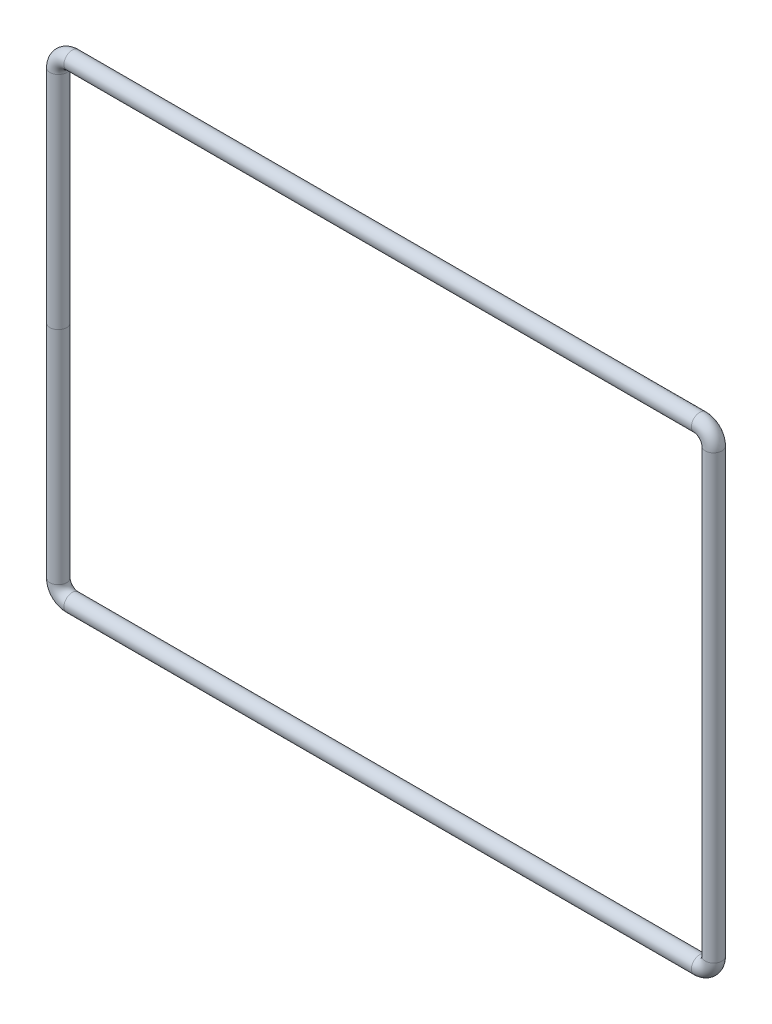
from build123d import *

# Parameters (mm, degrees)
SKETCH_2_R = 0.9


with BuildPart() as part:
    # По траектории1: sweep along a path in Эскиз1
    with BuildLine(Plane.XY) as sweep_1_path:
        Line((-33.8, 25.3), (33.8, 25.3))
        ThreePointArc((33.8, 25.3), (34.860660172, 24.860660172), (35.3, 23.8))
        Line((35.3, 23.8), (35.3, -23.8))
        ThreePointArc((35.3, -23.8), (34.860660172, -24.860660172), (33.8, -25.3))
        Line((33.8, -25.3), (-33.8, -25.3))
        ThreePointArc((-33.8, -25.3), (-34.860660172, -24.860660172), (-35.3, -23.8))
        Line((-35.3, -23.8), (-35.3, 23.8))
        ThreePointArc((-35.3, 23.8), (-34.860660172, 24.860660172), (-33.8, 25.3))
    # Эскиз2 → По траектории1 (sweep)
    with BuildSketch(Plane(origin=(0, 0, 0), x_dir=(-1, 0, 0), z_dir=(0, -1, 0))):
        with Locations((35.3, 0)):
            Circle(SKETCH_2_R)
    sweep(path=sweep_1_path.line)


solid = part.part
